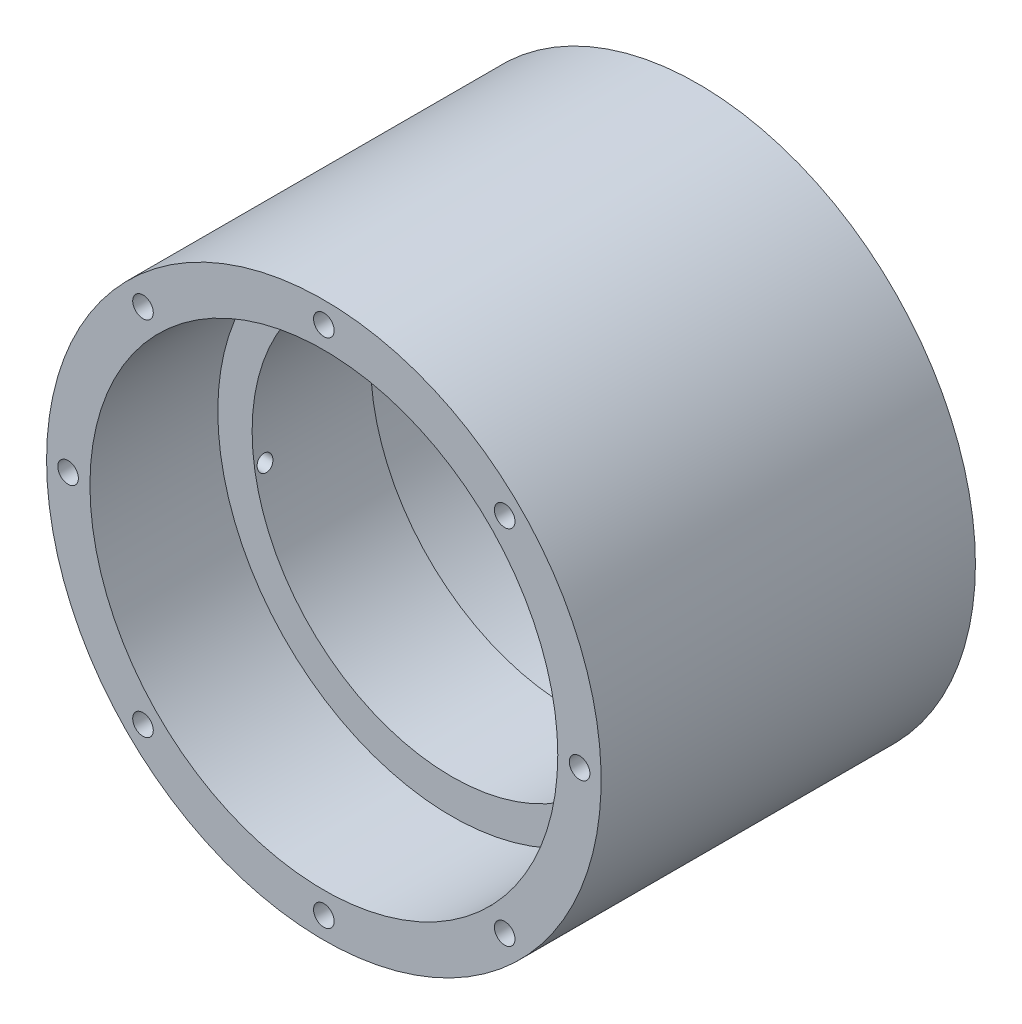
from build123d import *

# Parameters (mm, degrees)
SKETCH1_W                  = 44.45
SKETCH1_H                  = 60
CUT_EXTRUDE1_START         = -50
CUT_EXTRUDE1_DEPTH         = 50
M4X0_7_TAPPED_HOLE1_D      = 3.3
M4X0_7_TAPPED_HOLE1_DEPTH  = 10
M4X0_7_TAPPED_HOLE1_TIP    = 0.991420021
M3X0_5_TAPPED_HOLE1_REACH  = 117.544
M3X0_5_TAPPED_HOLE1_BORE_R = 1.25
M3X0_5_TAPPED_HOLE2_REACH  = 117.544
M3X0_5_TAPPED_HOLE2_BORE_R = 1.25


with BuildPart() as part:
    # Sketch1 → Revolve1 (revolve)
    with BuildSketch(Plane.XZ, mode=Mode.PRIVATE) as revolve1_sk:
        with Locations((22.225, 30)):
            Rectangle(SKETCH1_W, SKETCH1_H)
    revolve(revolve1_sk.sketch.rotate(Axis((0, 0, 60), (0, 0, -1)), 180), axis=Axis((0, 0, 60), (0, 0, -1)))

    # Sketch2 → Cut-Extrude1 (cut)
    with BuildSketch(Plane(origin=(0, 0, 0), x_dir=(-1, 0, 0), z_dir=(0, 0, -1)).offset(CUT_EXTRUDE1_START)):
        with BuildLine():
            Line((43.7241638, 8), (43.7241638, -8))
            ThreePointArc((43.7241638, -8), (44.45, 0), (43.7241638, 8))
        make_face()
    extrude(amount=CUT_EXTRUDE1_DEPTH, mode=Mode.SUBTRACT)

    # Sketch3 → Cut-Revolve1 (revolve, cut)
    with BuildSketch(Plane.XZ, mode=Mode.PRIVATE) as cut_revolve1_sk:
        Polygon((37.5, 60), (0, 60), (0, 0), (37.5, 0), (37.5, 20.5), (32, 20.5), (32, 39.5), (37.5, 39.5), align=None)
    revolve(cut_revolve1_sk.sketch.rotate(Axis((0, 0, 60), (0, 0, -1)), 180), axis=Axis((0, 0, 60), (0, 0, -1)), mode=Mode.SUBTRACT)

    # M4x0.7 Tapped Hole1
    with Locations(Plane.XY.offset(60)):
        with Locations((28.991378029, 28.991378029), (0, 41), (-28.991378029, 28.991378029), (-41, 0), (-28.991378029, -28.991378029), (0, -41), (28.991378029, -28.991378029), (41, 0)):
            Hole(M4X0_7_TAPPED_HOLE1_D / 2, depth=M4X0_7_TAPPED_HOLE1_DEPTH)
            with Locations((0, 0, -(M4X0_7_TAPPED_HOLE1_DEPTH + M4X0_7_TAPPED_HOLE1_TIP / 2))):  # 118° drill point
                Cone(0, M4X0_7_TAPPED_HOLE1_D / 2, M4X0_7_TAPPED_HOLE1_TIP, mode=Mode.SUBTRACT)

    # M3x0.5 Tapped Hole1 bore → M3x0.5 Tapped Hole1 (cut, up to next)
    with BuildSketch(Plane.ZY.offset(43.7241638), mode=Mode.PRIVATE) as m3x0_5_tapped_hole1_sk1:
        with Locations((15.584748033, 5.15)):
            Circle(M3X0_5_TAPPED_HOLE1_BORE_R)
    m3x0_5_tapped_hole1_tool1 = extrude(m3x0_5_tapped_hole1_sk1.sketch, amount=-M3X0_5_TAPPED_HOLE1_REACH, mode=Mode.PRIVATE) & part.part
    add(m3x0_5_tapped_hole1_tool1.solids().sort_by_distance((-43.724164, 5.15, 15.584748))[0], mode=Mode.SUBTRACT)

    # M3x0.5 Tapped Hole2 bore → M3x0.5 Tapped Hole2 (cut, up to next)
    with BuildSketch(Plane.ZY.offset(43.7241638), mode=Mode.PRIVATE) as m3x0_5_tapped_hole2_sk1:
        with Locations((37.834748033, -5.05)):
            Circle(M3X0_5_TAPPED_HOLE2_BORE_R)
    m3x0_5_tapped_hole2_tool1 = extrude(m3x0_5_tapped_hole2_sk1.sketch, amount=-M3X0_5_TAPPED_HOLE2_REACH, mode=Mode.PRIVATE) & part.part
    add(m3x0_5_tapped_hole2_tool1.solids().sort_by_distance((-43.724164, -5.05, 37.834748))[0], mode=Mode.SUBTRACT)


solid = part.part
